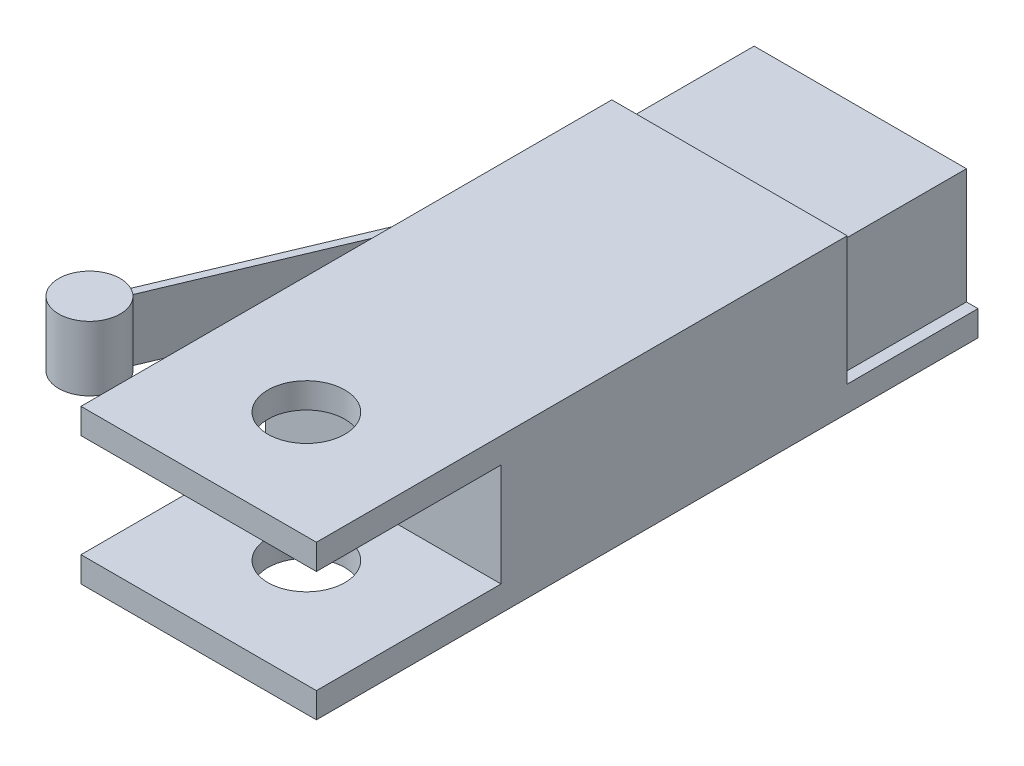
from build123d import *

# Parameters (mm, degrees)
SKETCH1_W                = 15.3
SKETCH1_H                = 43
BOSS_EXTRUDE1_DEPTH      = 10
SKETCH2_W                = 12
SKETCH2_H                = 6.7
SKETCH2_W_2              = 8.5
SKETCH2_H_2              = 8.35
CUT_EXTRUDE1_DEPTH       = 29.219496806
SKETCH3_W                = 13.8
SKETCH3_H                = 8
BOSS_EXTRUDE2_DEPTH      = 7.5
CUT_EXTRUDE2_DEPTH       = 7.5
LPATTERN1_COUNT          = 3
LPATTERN1_PITCH          = 4.433333333
BOSS_EXTRUDE3_DEPTH      = 4
BOSS_EXTRUDE4_DEPTH      = 4.1
BOSS_EXTRUDE4_DEPTH_BACK = 0.1
SKETCH7_R                = 2
SKETCH8_R                = 2.5
CUT_EXTRUDE3_DEPTH       = 31.057587225


with BuildPart() as part:
    # Sketch1 → Boss-Extrude1 (new body)
    with BuildSketch(Plane(origin=(0, 0, 0), x_dir=(1, 0, 0), z_dir=(0, 1, 0))):
        Rectangle(SKETCH1_W, SKETCH1_H)
    extrude(amount=BOSS_EXTRUDE1_DEPTH)

    # Sketch2 → Cut-Extrude1 (cut, through all)
    with BuildSketch(Plane(origin=(7.65, 0, 0), x_dir=(0, 0, -1), z_dir=(1, 0, 0))):
        with Locations((-15.5, 5)):
            Rectangle(SKETCH2_W, SKETCH2_H)
        with Locations((17.25, 5.825)):
            Rectangle(SKETCH2_W_2, SKETCH2_H_2)
    extrude(amount=-CUT_EXTRUDE1_DEPTH, mode=Mode.SUBTRACT)

    # Sketch8 → Cut-Extrude3 (cut, through all)
    with BuildSketch(Plane.XZ):
        with Locations(Location((0, 14.5, 0), (0, 0, 270))):
            Circle(SKETCH8_R)
    extrude(amount=-CUT_EXTRUDE3_DEPTH, mode=Mode.SUBTRACT)


with BuildPart() as body_2:
    # Sketch3 → Boss-Extrude2 (new body)
    with BuildSketch(Plane(origin=(0, 1.65, 0), x_dir=(1, 0, 0), z_dir=(0, 1, 0))):
        with Locations((0, 17.5)):
            Rectangle(SKETCH3_W, SKETCH3_H)
    extrude(amount=BOSS_EXTRUDE2_DEPTH)

    # Sketch4 → Cut-Extrude2 (cut)
    with BuildSketch(Plane(origin=(0, 0, -21.5), x_dir=(-1, 0, 0), z_dir=(0, 0, -1))):
        Polygon((-6.4, 1.65), (-6.4, 7.65), (-5.6, 7.65), (-6.3999967, 8.65), (-2.4666667, 8.65), (-3.2666667, 7.65), (-2.4666667, 7.65), (-2.4666667, 1.65), align=None)
    cut_extrude2 = extrude(amount=-CUT_EXTRUDE2_DEPTH, mode=Mode.SUBTRACT)

    # LPattern1: Cut-Extrude2 ×3
    with Locations(*[(-i * LPATTERN1_PITCH, 0, 0) for i in range(1, LPATTERN1_COUNT)]):
        add(cut_extrude2, mode=Mode.SUBTRACT)


with BuildPart() as body_3:
    # Sketch6 → Boss-Extrude3 (new body)
    with BuildSketch(Plane(origin=(0, 3, 0), x_dir=(1, 0, 0), z_dir=(0, 1, 0))):
        Polygon((-6.77634418, 10.917443401), (-16.471831252, -12.125940258), (-16.010963579, -12.319849999), (-6.315476506, 10.723533659), align=None)
    extrude(amount=BOSS_EXTRUDE3_DEPTH)


with BuildPart() as body_4:
    # Sketch7 → Boss-Extrude4 (new, two sides: drawn at the far end of the back side and taken through both)
    with BuildSketch(Plane(origin=(0, 3, 0), x_dir=(1, 0, 0), z_dir=(0, 1, 0)).offset(-BOSS_EXTRUDE4_DEPTH_BACK)):
        with Locations(Location((-16.471831252, -12.125940258, 0), (0, 0, 270))):
            Circle(SKETCH7_R)
    extrude(amount=BOSS_EXTRUDE4_DEPTH + BOSS_EXTRUDE4_DEPTH_BACK)


solid = Compound([part.part, body_2.part, body_3.part, body_4.part])
